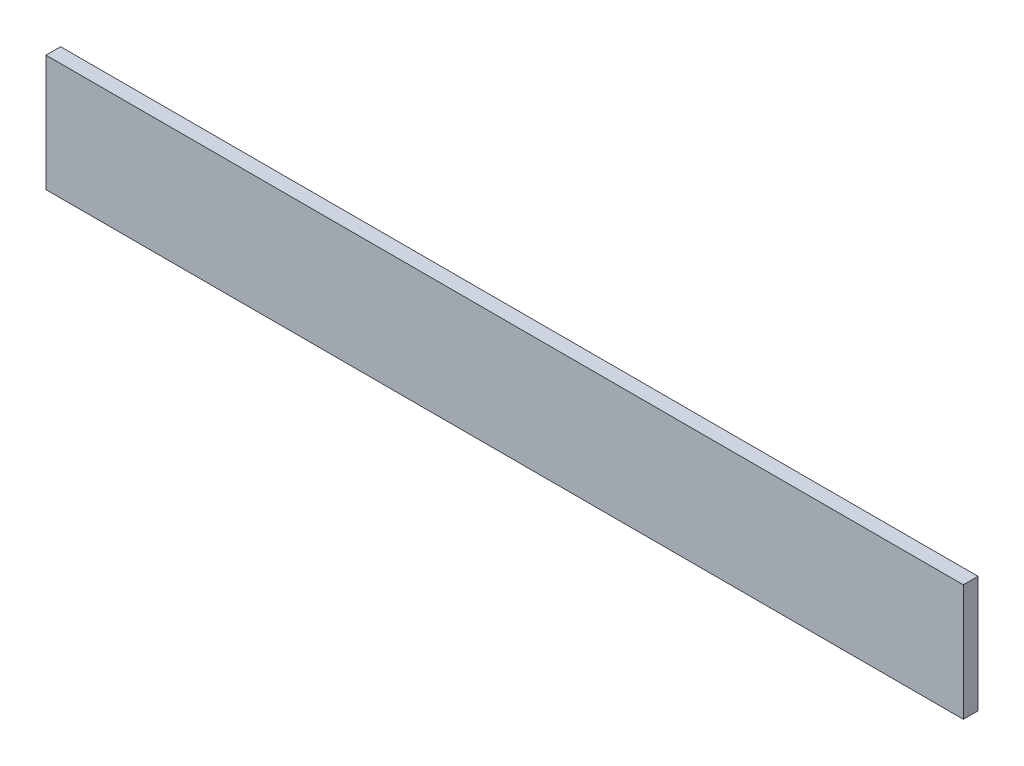
from build123d import *

# Parameters (mm, degrees)
SKETCH1_W           = 0.8
SKETCH1_H           = 6.35
BOSS_EXTRUDE1_DEPTH = 50


with BuildPart() as part:
    # Sketch1 → Boss-Extrude1 (new body)
    with BuildSketch(Plane(origin=(0, 0, 0), x_dir=(0, 0, -1), z_dir=(1, 0, 0))):
        with Locations((0.4, 3.175)):
            Rectangle(SKETCH1_W, SKETCH1_H)
    extrude(amount=BOSS_EXTRUDE1_DEPTH)


solid = part.part
